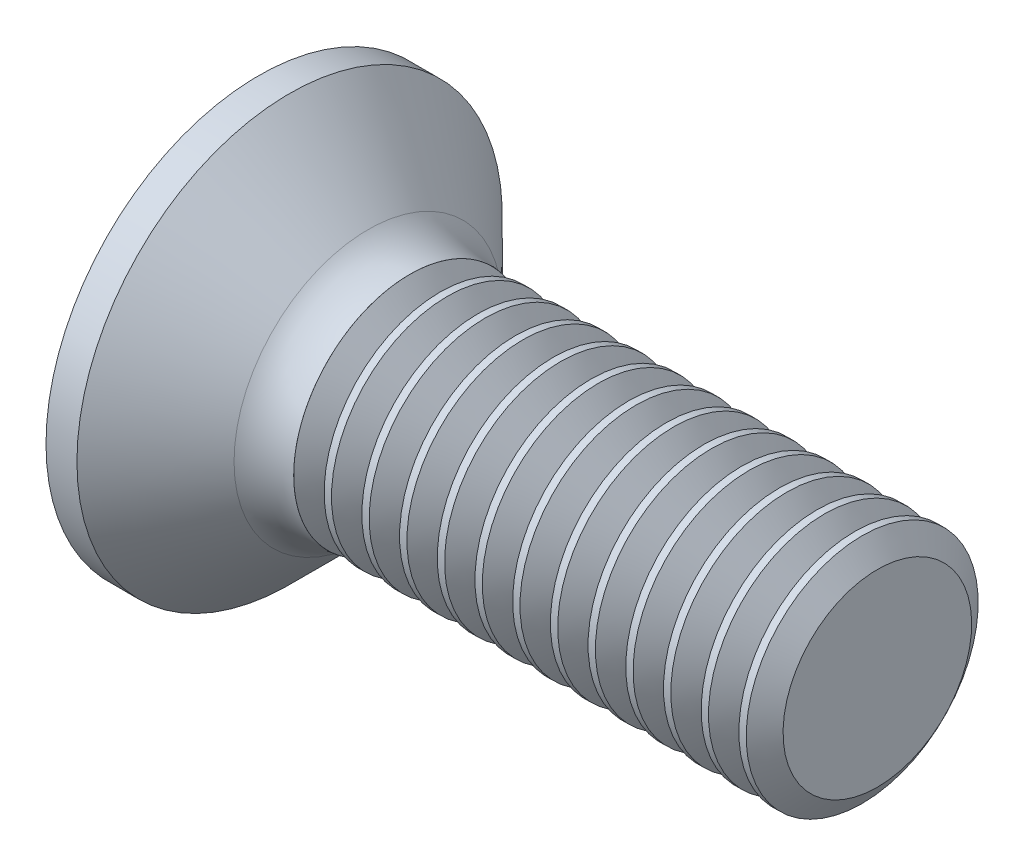
from build123d import *

# Parameters (mm, degrees)
FILLET1_R       = 0.8
RECPAT_COUNT    = 2
RECPAT_ANGLE    = 90
THDSCHPAT_COUNT = 13
THDSCHPAT_PITCH = 0.4875


with BuildPart() as part:
    # BodySke → Base-Revolve (revolve)
    with BuildSketch(Plane.XY, mode=Mode.PRIVATE) as base_revolve_sk:
        with BuildLine():
            Line((0, 0), (8.7, 0))
            Line((8.7, 0), (8.7, 1.5))
            Line((8.7, 1.5), (2.35, 1.5))
            Line((2.35, 1.5), (1.1, 2.75))
            Line((1.1, 2.75), (0.7, 2.75))
            ThreePointArc((0.7, 2.75), (0.177746434, 1.418846362), (0, 0))
        make_face()
    revolve(base_revolve_sk.sketch.rotate(Axis((-15.875, 0, 0), (1, 0, 0)), 90), axis=Axis((-15.875, 0, 0), (1, 0, 0)))

    # Fillet1
    fillet1_edges = [part.edges().sort_by_distance(p)[0] for p in [
        (2.35, 0, -1.5),
    ]]
    fillet(fillet1_edges, radius=FILLET1_R)

    # Sketch3 → Recess section 0
    with BuildSketch(Plane(origin=(0, 0, 0), x_dir=(0, 0, -1), z_dir=(1, 0, 0))):
        with BuildLine():
            Line((0.37, -1.55), (-0.37, -1.55))
            Line((-0.37, -1.55), (-0.37, 1.55))
            Line((-0.37, 1.55), (0.37, 1.55))
            Line((0.37, 1.55), (0.37, -1.55))
        make_face()
    # Sketch4 → Recess section 1
    with BuildSketch(Plane(origin=(2.08, 0, 0), x_dir=(0, 0, -1), z_dir=(1, 0, 0))):
        with BuildLine():
            Line((0.37, -0.512950429), (-0.37, -0.512950429))
            Line((-0.37, -0.512950429), (-0.37, 0.512950429))
            Line((-0.37, 0.512950429), (0.37, 0.512950429))
            Line((0.37, 0.512950429), (0.37, -0.512950429))
        make_face()
    recess = loft(mode=Mode.SUBTRACT)

    # RecPat: Recess ×2 about axis
    recpat_axis = Axis((0, 0, 0), (1, 0, 0))
    for i in range(1, RECPAT_COUNT):
        add(recess.rotate(recpat_axis, i * RECPAT_ANGLE / (RECPAT_COUNT - 1)), mode=Mode.SUBTRACT)

    # RecCorSke → RecessCore (revolve, cut)
    with BuildSketch(Plane.XY, mode=Mode.PRIVATE) as recesscore_sk:
        Polygon((0, 0), (0, 0.701447769), (2.08, 0.556), (2.260655351, 0), align=None)
    revolve(recesscore_sk.sketch.rotate(Axis((-3.175, 0, 0), (1, 0, 0)), 90), axis=Axis((-3.175, 0, 0), (1, 0, 0)), mode=Mode.SUBTRACT)

    # ThdSchSke → ThreadSchematic (revolve, cut)
    with BuildSketch(Plane.XY):
        Polygon((2.85, -1.2195), (2.653591786, -1.5), (2.653591786, -1.875), (3.046408214, -1.875), (3.046408214, -1.5), align=None)
    threadschematic = revolve(axis=Axis((-3.175, 0, 0), (1, 0, 0)), mode=Mode.SUBTRACT)

    # ThdSchPat: ThreadSchematic ×13
    with Locations(*[(i * THDSCHPAT_PITCH, 0, 0) for i in range(1, THDSCHPAT_COUNT)]):
        add(threadschematic, mode=Mode.SUBTRACT)


solid = part.part
